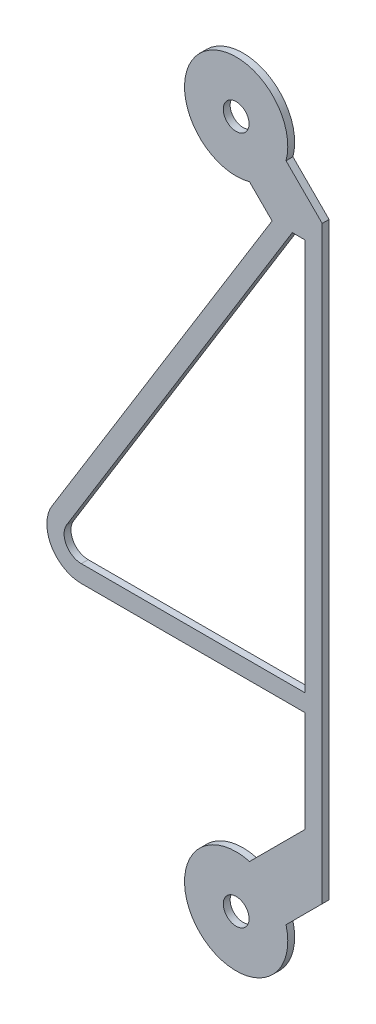
from build123d import *

# Parameters (mm, degrees)
SKETCH1_R           = 0.375
BOSS_EXTRUDE1_DEPTH = 0.1


with BuildPart() as part:
    # Sketch1 → Boss-Extrude1 (new, symmetric)
    with BuildSketch(Plane.XY):
        with BuildLine():
            Line((1.04409719, 7.895242639), (-5.351162932, -2.475098425))
            ThreePointArc((-5.351162932, -2.475098425), (-5.37318428, -3.487390206), (-4.5, -4))
            Line((-4.5, -4), (2, -4))
            Line((2, -4), (2, -6.939339828))
            Line((2, -6.939339828), (0.388228568, -8.551111261))
            ThreePointArc((0.388228568, -8.551111261), (-1.060660172, -11.060660172), (1.448888739, -9.611771432))
            Line((1.448888739, -9.611771432), (2.5, -8.560660172))
            Line((2.5, -8.560660172), (2.5, 8.560660172))
            Line((2.5, 8.560660172), (1.448888739, 9.611771432))
            ThreePointArc((1.448888739, 9.611771432), (-1.060660172, 11.060660172), (0.388228568, 8.551111261))
            Line((0.388228568, 8.551111261), (1.04409719, 7.895242639))
        make_face()
        with Locations((0, 10)):
            Circle(SKETCH1_R, mode=Mode.SUBTRACT)
        with Locations((0, -10)):
            Circle(SKETCH1_R, mode=Mode.SUBTRACT)
        with BuildLine():
            Line((1.631528786, 7.895242639), (-4.925581466, -2.737549213))
            ThreePointArc((-4.925581466, -2.737549213), (-4.93659214, -3.243695103), (-4.5, -3.5))
            Line((-4.5, -3.5), (2, -3.5))
            Line((2, -3.5), (2, 7.895242639))
            Line((2, 7.895242639), (1.631528786, 7.895242639))
        make_face(mode=Mode.SUBTRACT)
    extrude(amount=BOSS_EXTRUDE1_DEPTH, both=True)


solid = part.part
